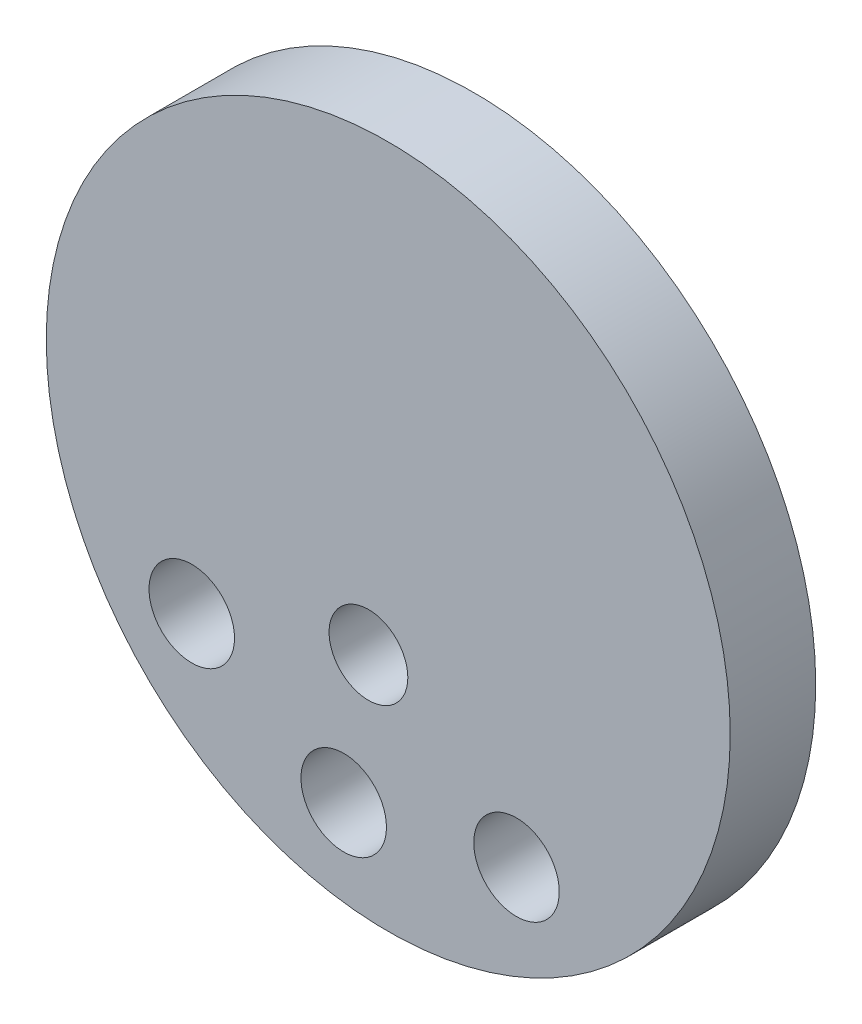
from build123d import *

# Parameters (mm, degrees)
SKETCH1_R           = 20
BOSS_EXTRUDE1_DEPTH = 5
SKETCH2_R           = 2.5
SKETCH2_R_2         = 2.302418505
CUT_EXTRUDE1_DEPTH  = 35


with BuildPart() as part:
    # Sketch1 → Boss-Extrude1 (new body)
    with BuildSketch(Plane.XY):
        Circle(SKETCH1_R)
    extrude(amount=BOSS_EXTRUDE1_DEPTH)

    # Sketch2 → Cut-Extrude1 (cut)
    with BuildSketch(Plane.XY.offset(5)):
        with Locations((7.5, -12.990381057)):
            Circle(SKETCH2_R)
        with Locations((-2.604722665, -14.772116295)):
            Circle(SKETCH2_R)
        with Locations((-11.490666647, -9.641814145)):
            Circle(SKETCH2_R)
        with Locations((-1.157655097, -6.565388303)):
            Circle(SKETCH2_R_2)
    extrude(amount=-CUT_EXTRUDE1_DEPTH, mode=Mode.SUBTRACT)


solid = part.part
